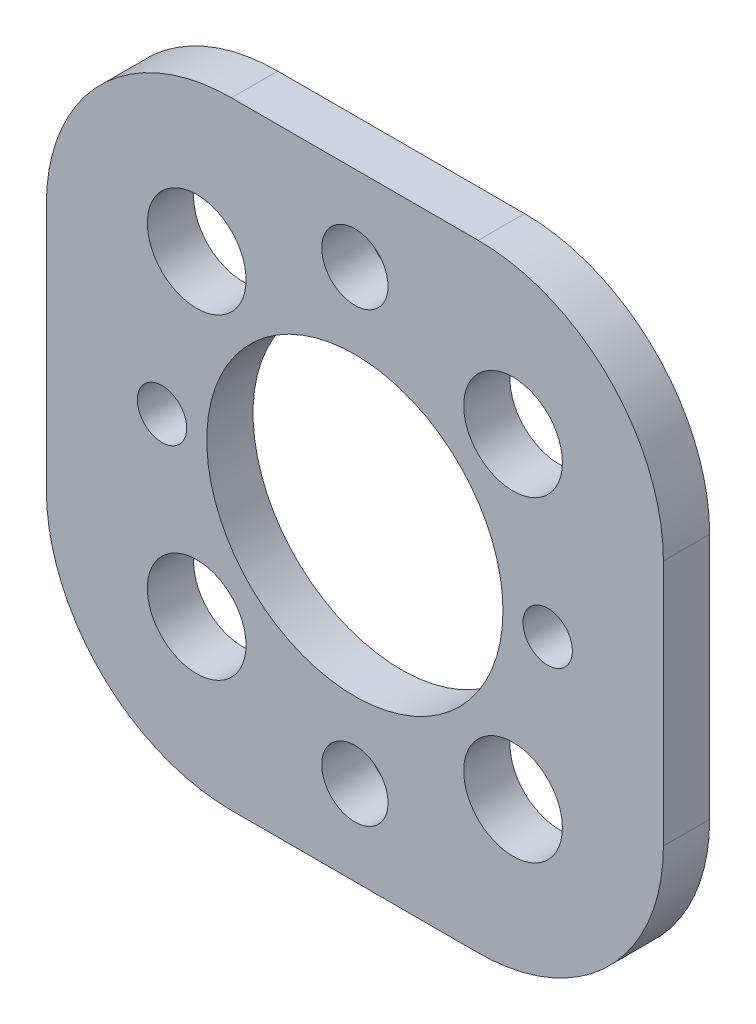
from build123d import *

# Parameters (mm, degrees)
SKETCH1_R           = 9.6
SKETCH1_R_2         = 2.15
SKETCH1_R_3         = 1.6
SKETCH1_R_4         = 3.2
BOSS_EXTRUDE1_DEPTH = 3


with BuildPart() as part:
    # Sketch1 → Boss-Extrude1 (new body)
    with BuildSketch(Plane.XY):
        with BuildLine():
            Line((8, -20), (-8, -20))
            ThreePointArc((-8, -20), (-16.485281374, -16.485281374), (-20, -8))
            Line((-20, -8), (-20, 8))
            ThreePointArc((-20, 8), (-16.485281374, 16.485281374), (-8, 20))
            Line((-8, 20), (8, 20))
            ThreePointArc((8, 20), (16.485281374, 16.485281374), (20, 8))
            Line((20, 8), (20, -8))
            ThreePointArc((20, -8), (16.485281374, -16.485281374), (8, -20))
        make_face()
        Circle(SKETCH1_R, mode=Mode.SUBTRACT)
        with Locations((0, 14.5)):
            Circle(SKETCH1_R_2, mode=Mode.SUBTRACT)
        with Locations((-12.5, 0)):
            Circle(SKETCH1_R_3, mode=Mode.SUBTRACT)
        with Locations((12.5, 0)):
            Circle(SKETCH1_R_3, mode=Mode.SUBTRACT)
        with Locations((0, -14.5)):
            Circle(SKETCH1_R_2, mode=Mode.SUBTRACT)
        with Locations((10.253048327, 10.253048327)):
            Circle(SKETCH1_R_4, mode=Mode.SUBTRACT)
        with Locations((10.253048327, -10.253048327)):
            Circle(SKETCH1_R_4, mode=Mode.SUBTRACT)
        with Locations((-10.253048327, -10.253048327)):
            Circle(SKETCH1_R_4, mode=Mode.SUBTRACT)
        with Locations((-10.253048327, 10.253048327)):
            Circle(SKETCH1_R_4, mode=Mode.SUBTRACT)
    extrude(amount=BOSS_EXTRUDE1_DEPTH)


solid = part.part
